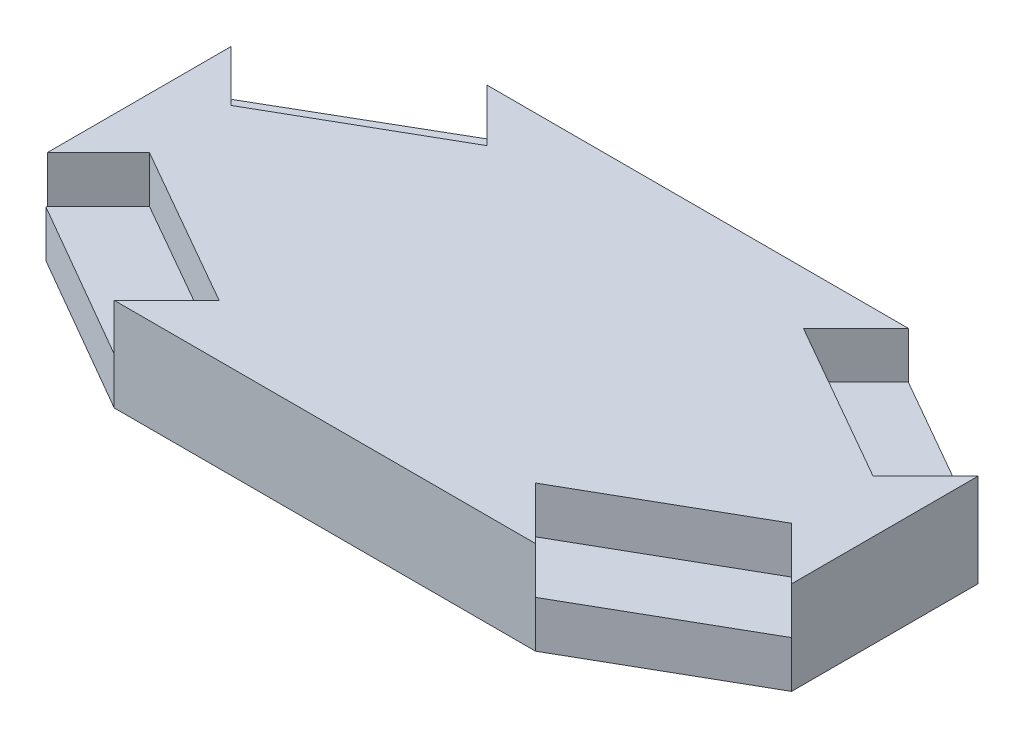
from build123d import *

# Parameters (mm, degrees)
BOSS_EXTRUDE1_DEPTH = 6.35
CUT_EXTRUDE1_DEPTH  = 3.175


with BuildPart() as part:
    # Sketch2 → Boss-Extrude1 (new body)
    with BuildSketch(Plane(origin=(0, 0, 0), x_dir=(1, 0, 0), z_dir=(0, 1, 0))):
        Polygon((50.8, 6.35), (50.8, -6.35), (39.700522628, -12.7), (10.998522628, -12.7), (0, -6.35), (0, 6.35), (10.998522628, 12.7), (39.700522628, 12.7), align=None)
    extrude(amount=BOSS_EXTRUDE1_DEPTH)

    # Sketch3 → Cut-Extrude1 (cut)
    with BuildSketch(Plane(origin=(0, 6.35, 0), x_dir=(1, 0, 0), z_dir=(0, 1, 0))):
        Polygon((39.700522628, -12.7), (50.8, -6.35), (47.227370356, -2.777370356), (36.127892984, -9.127370356), align=None)
        Polygon((-0.100954744, -6.35), (3.4716749, -2.777370356), (14.571152272, -9.127370356), (10.998522628, -12.7), align=None)
        Polygon((50.8, 6.35), (47.227370356, 2.777370356), (36.127892984, 9.127370356), (39.700522628, 12.7), align=None)
        Polygon((10.998522628, 12.7), (-0.100954744, 6.35), (3.4716749, 2.777370356), (14.571152272, 9.127370356), align=None)
    extrude(amount=-CUT_EXTRUDE1_DEPTH, mode=Mode.SUBTRACT)


solid = part.part
